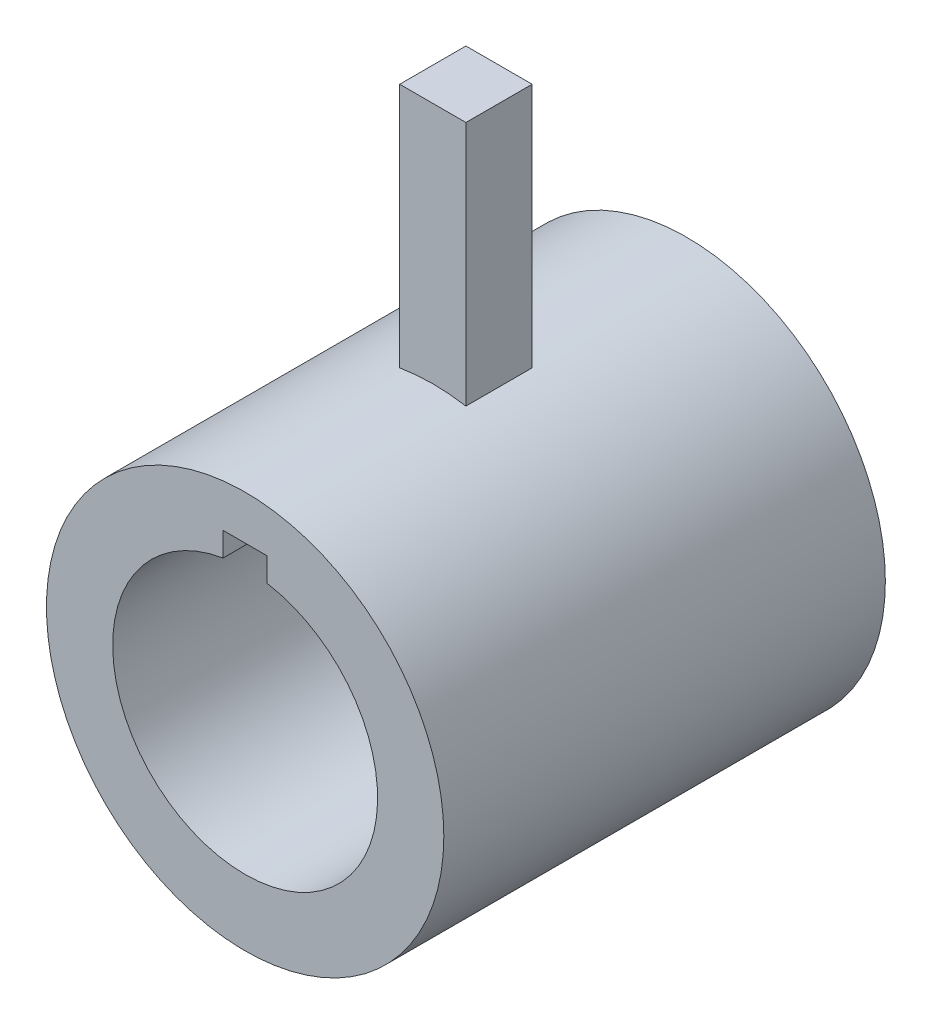
from build123d import *

# Parameters (mm, degrees)
SKETCH1_R           = 4.5
BOSS_EXTRUDE1_DEPTH = 10
BOSS_EXTRUDE3_START = 4
SKETCH3_W           = 1.5
SKETCH3_H           = 1.5
BOSS_EXTRUDE3_DEPTH = 6


with BuildPart() as part:
    # Sketch1 → Boss-Extrude1 (new body)
    with BuildSketch(Plane.XY):
        Circle(SKETCH1_R)
        with BuildLine():
            Line((0.5, 2.958039892), (0.5, 3.5))
            Line((0.5, 3.5), (-0.5, 3.5))
            Line((-0.5, 3.5), (-0.5, 2.958039892))
            ThreePointArc((-0.5, 2.958039892), (0, -3), (0.5, 2.958039892))
        make_face(mode=Mode.SUBTRACT)
    extrude(amount=BOSS_EXTRUDE1_DEPTH)

    # Sketch3 → Boss-Extrude3 (add)
    with BuildSketch(Plane(origin=(0, 0, 0), x_dir=(1, 0, 0), z_dir=(0, 1, 0)).offset(BOSS_EXTRUDE3_START)):
        with Locations((0, -5)):
            Rectangle(SKETCH3_W, SKETCH3_H)
    extrude(amount=BOSS_EXTRUDE3_DEPTH)


solid = part.part
